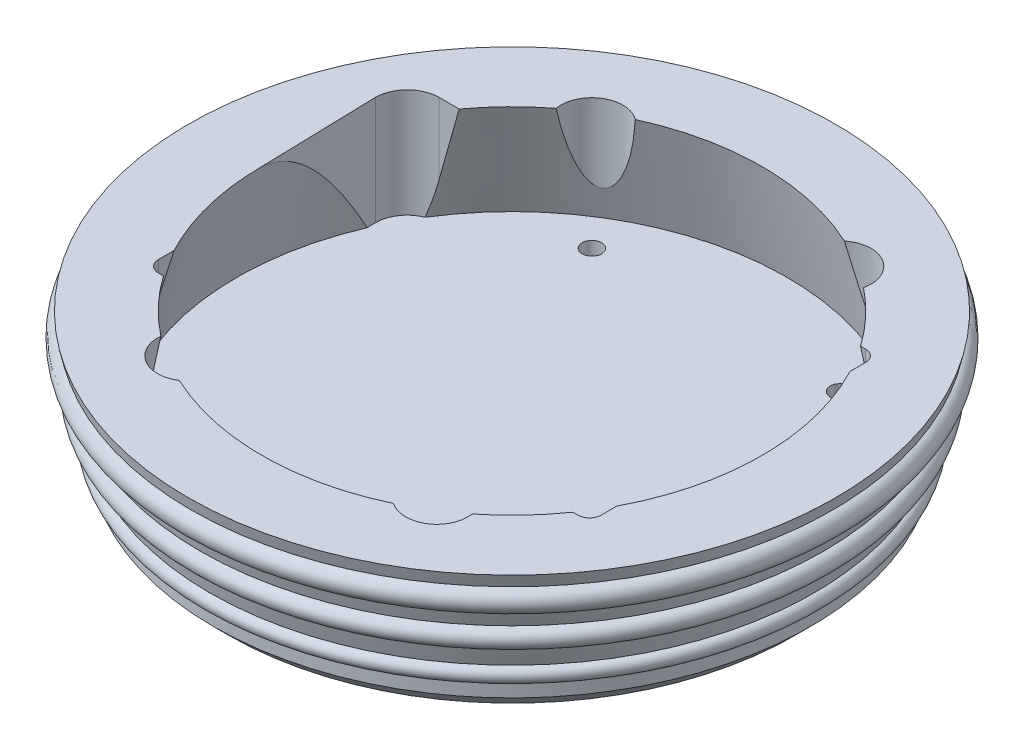
from build123d import *

# Parameters (mm, degrees)
SKETCH1_R           = 38.5
BOSS_EXTRUDE1_DEPTH = 4
SKETCH2_R           = 38.5
SKETCH2_R_2         = 35.5
BOSS_EXTRUDE2_DEPTH = 14
BOSS_EXTRUDE2_DRAFT = -13
CUT_EXTRUDE1_REACH  = 63.702
FILLET2_R           = 1.5
SKETCH7_R           = 1.25
CUT_EXTRUDE4_DEPTH  = 4
SKETCH8_R           = 4
CUT_EXTRUDE5_DEPTH  = 14
SKETCH10_R          = 1.25
SKETCH13_R          = 1.5
SKETCH14_R          = 1
CHAMFER1_SIZE       = 2
CUT_EXTRUDE7_REACH  = 64.742


with BuildPart() as part:
    # Sketch1 → Boss-Extrude1 (new body)
    with BuildSketch(Plane(origin=(0, 0, 0), x_dir=(1, 0, 0), z_dir=(0, 1, 0))):
        with Locations(Location((0, 0, 0), (0, 0, 270))):
            Circle(SKETCH1_R)
    extrude(amount=BOSS_EXTRUDE1_DEPTH)


with BuildPart() as boss_extrude2_tool:
    # Sketch2 → Boss-Extrude2 (with draft: the straight prism first)
    with BuildSketch(Plane(origin=(0, 4, 0), x_dir=(1, 0, 0), z_dir=(0, 1, 0))):
        with Locations(Location((0, 0, 0), (0, 0, 270))):
            Circle(SKETCH2_R)
        Circle(SKETCH2_R_2, mode=Mode.SUBTRACT)
    extrude(amount=BOSS_EXTRUDE2_DEPTH)
    # Boss-Extrude2: the draft: its side faces are tilted about the plane it starts from
    boss_extrude2_sides = [boss_extrude2_tool.faces().sort_by_distance(p)[0] for p in [
        (0, 11, -38.5),
        (-35.5, 11, 0),
    ]]
    draft(boss_extrude2_sides, Plane(origin=(0, 4, 0), x_dir=(1, 0, 0), z_dir=(0, 1, 0)), BOSS_EXTRUDE2_DRAFT)


with BuildPart() as part_1:
    add(part.part)

    # Boss-Extrude2: add boss_extrude2_tool
    add(boss_extrude2_tool.part)

    # Cut-Extrude1: up to this face of the body (flat: up to its plane)
    cut_extrude1_end = Plane(part_1.part.faces().sort_by_distance((0, 4, 0))[0])
    # Sketch3 → Cut-Extrude1 (cut, up to the picked face)
    with BuildSketch(Plane(origin=(0, 18, 0), x_dir=(1, 0, 0), z_dir=(0, 1, 0)), mode=Mode.PRIVATE) as cut_extrude1_sk1:
        Polygon((18.55, -28.55), (18.55, -18.55), (28.55, -18.55), (28.55, 18.55), (18.55, 18.55), (18.55, 28.55), (-18.55, 28.55), (-18.55, 18.55), (-28.55, 18.55), (-28.55, -18.55), (-18.55, -18.55), (-18.55, -28.55), align=None)
    cut_extrude1_tool1 = split(extrude(cut_extrude1_sk1.sketch, amount=-CUT_EXTRUDE1_REACH, mode=Mode.PRIVATE), bisect_by=cut_extrude1_end, keep=Keep.BOTH, mode=Mode.PRIVATE)
    add(cut_extrude1_tool1.solids().sort_by(Axis((0, 18, 0), (0, -1, 0)))[0], mode=Mode.SUBTRACT)

    # Fillet2
    fillet2_edges = [part_1.edges().sort_by_distance(p)[0] for p in [
        (-28.55, 14.146601234, 18.55),
        (-28.55, 14.146601234, -18.55),
        (28.55, 14.146601234, -18.55),
        (28.55, 14.146601234, 18.55),
    ]]
    fillet(fillet2_edges, radius=FILLET2_R)

    # Sketch7 → Cut-Extrude4 (cut)
    with BuildSketch(Plane(origin=(0, 4, 0), x_dir=(1, 0, 0), z_dir=(0, 1, 0))):
        with Locations(Location((16.15, 26.15, 0), (0, 0, 270))):
            Circle(SKETCH7_R)
        with Locations(Location((16.15, -25.85, 0), (0, 0, 270))):
            Circle(SKETCH7_R)
        with Locations(Location((-15.85, -25.85, 0), (0, 0, 270))):
            Circle(SKETCH7_R)
        with Locations(Location((-15.85, 26.15, 0), (0, 0, 270))):
            Circle(SKETCH7_R)
    extrude(amount=-CUT_EXTRUDE4_DEPTH, mode=Mode.SUBTRACT)

    # Sketch8 → Cut-Extrude5 (cut)
    with BuildSketch(Plane(origin=(0, 4, 0), x_dir=(1, 0, 0), z_dir=(0, 1, 0))):
        with Locations((-15.85, -25.85)):
            Circle(SKETCH8_R)
        with Locations((-15.85, 26.15)):
            Circle(SKETCH8_R)
        with Locations((16.15, -25.85)):
            Circle(SKETCH8_R)
        with Locations((16.15, 26.15)):
            Circle(SKETCH8_R)
    extrude(amount=CUT_EXTRUDE5_DEPTH, mode=Mode.SUBTRACT)

    # Sweep1: sweep along a path in Sketch9
    with BuildLine(Plane(origin=(0, 10, 0), x_dir=(-1, 0, 0), z_dir=(0, -1, 0))) as sweep1_path:
        CenterArc((0, 0), 40, 0, 360)
    # Sketch10 → Sweep1 (sweep)
    with BuildSketch(Plane(origin=(0, 0, 0), x_dir=(0, 0, -1), z_dir=(1, 0, 0))):
        with Locations((40, 10)):
            Circle(SKETCH10_R)
    sweep(path=sweep1_path.line)

    # Sweep2: sweep along a path in Sketch11
    with BuildLine(Plane(origin=(0, 15, 0), x_dir=(-1, 0, 0), z_dir=(0, -1, 0))) as sweep2_path:
        CenterArc((0, 0), 41, 0, 360)
    # Sketch13 → Sweep2 (sweep)
    with BuildSketch(Plane(origin=(0, 0, 0), x_dir=(0, 0, -1), z_dir=(1, 0, 0))):
        with Locations((41, 15)):
            Circle(SKETCH13_R)
    sweep(path=sweep2_path.line)

    # Sweep3: sweep along a path in Sketch12
    with BuildLine(Plane(origin=(0, 5, 0), x_dir=(-1, 0, 0), z_dir=(0, -1, 0))) as sweep3_path:
        CenterArc((0, 0), 38.75, 0, 360)
    # Sketch14 → Sweep3 (sweep)
    with BuildSketch(Plane(origin=(0, 0, 0), x_dir=(0, 0, -1), z_dir=(1, 0, 0))):
        with Locations((38.75, 5)):
            Circle(SKETCH14_R)
    sweep(path=sweep3_path.line)

    # Chamfer1
    chamfer1_edges = [part_1.edges().sort_by_distance(p)[0] for p in [
        (0, 0, -38.5),
    ]]
    chamfer(chamfer1_edges, length=CHAMFER1_SIZE)

    # Cut-Extrude7: up to this face of the body (flat: up to its plane)
    cut_extrude7_end = Plane(part_1.part.faces().sort_by_distance((-0.000747608, 4, 0.000747608))[0])
    # Sketch15 → Cut-Extrude7 (cut, up to the picked face)
    with BuildSketch(Plane(origin=(0, 18, 0), x_dir=(1, 0, 0), z_dir=(0, 1, 0)), mode=Mode.PRIVATE) as cut_extrude7_sk1:
        with BuildLine():
            ThreePointArc((-28.55, 19.154201914), (-31.461302031, 17.948301129), (-32.667202817, 15.036999098))
            Line((-32.667202817, 15.036999098), (-32.661398817, 14.818461231))
            ThreePointArc((-32.661398817, 14.818461231), (-31.944617845, 12.707207537), (-30.232328928, 11.279190107))
            ThreePointArc((-30.232328928, 11.279190107), (-29.45116009, 13.184953971), (-28.55, 15.036999098))
            Line((-28.55, 15.036999098), (-28.55, 17.05))
            ThreePointArc((-28.55, 17.05), (-28.110660172, 18.110660172), (-27.05, 18.55))
            Line((-27.05, 18.55), (-26.402866168, 18.55))
            ThreePointArc((-26.402866168, 18.55), (-27.43473729, 19.000274022), (-28.55, 19.154201914))
        make_face()
    cut_extrude7_tool1 = split(extrude(cut_extrude7_sk1.sketch, amount=-CUT_EXTRUDE7_REACH, mode=Mode.PRIVATE), bisect_by=cut_extrude7_end, keep=Keep.BOTH, mode=Mode.PRIVATE)
    # Sketch15 → Cut-Extrude7 (cut, up to the picked face)
    with BuildSketch(Plane(origin=(0, 18, 0), x_dir=(1, 0, 0), z_dir=(0, 1, 0)), mode=Mode.PRIVATE) as cut_extrude7_sk2:
        with BuildLine():
            ThreePointArc((-30.232328928, 11.279190107), (-31.944617845, 12.707207537), (-32.661398817, 14.818461231))
            Line((-32.661398817, 14.818461231), (-32.267845324, 0))
            ThreePointArc((-32.267845324, 0), (-31.754889037, 5.730694907), (-30.232328928, 11.279190107))
        make_face()
    cut_extrude7_tool2 = split(extrude(cut_extrude7_sk2.sketch, amount=-CUT_EXTRUDE7_REACH, mode=Mode.PRIVATE), bisect_by=cut_extrude7_end, keep=Keep.BOTH, mode=Mode.PRIVATE)
    # Sketch15 → Cut-Extrude7 (cut, up to the picked face)
    with BuildSketch(Plane(origin=(0, 18, 0), x_dir=(1, 0, 0), z_dir=(0, 1, 0)), mode=Mode.PRIVATE) as cut_extrude7_sk3:
        with BuildLine():
            Line((-25.967872283, 19.154201914), (-28.55, 19.154201914))
            ThreePointArc((-28.55, 19.154201914), (-27.43473729, 19.000274022), (-26.402866168, 18.55))
            ThreePointArc((-26.402866168, 18.55), (-26.187111839, 18.853355548), (-25.967872283, 19.154201914))
        make_face()
    cut_extrude7_tool3 = split(extrude(cut_extrude7_sk3.sketch, amount=-CUT_EXTRUDE7_REACH, mode=Mode.PRIVATE), bisect_by=cut_extrude7_end, keep=Keep.BOTH, mode=Mode.PRIVATE)
    add(cut_extrude7_tool1.solids().sort_by(Axis((-30.343059, 18, -15.64249), (0, -1, 0)))[0], mode=Mode.SUBTRACT)
    add(cut_extrude7_tool2.solids().sort_by(Axis((-31.82225, 18, -9.084496), (0, -1, 0)))[0], mode=Mode.SUBTRACT)
    add(cut_extrude7_tool3.solids().sort_by(Axis((-26.771736, 18, -18.970288), (0, -1, 0)))[0], mode=Mode.SUBTRACT)


solid = part_1.part
